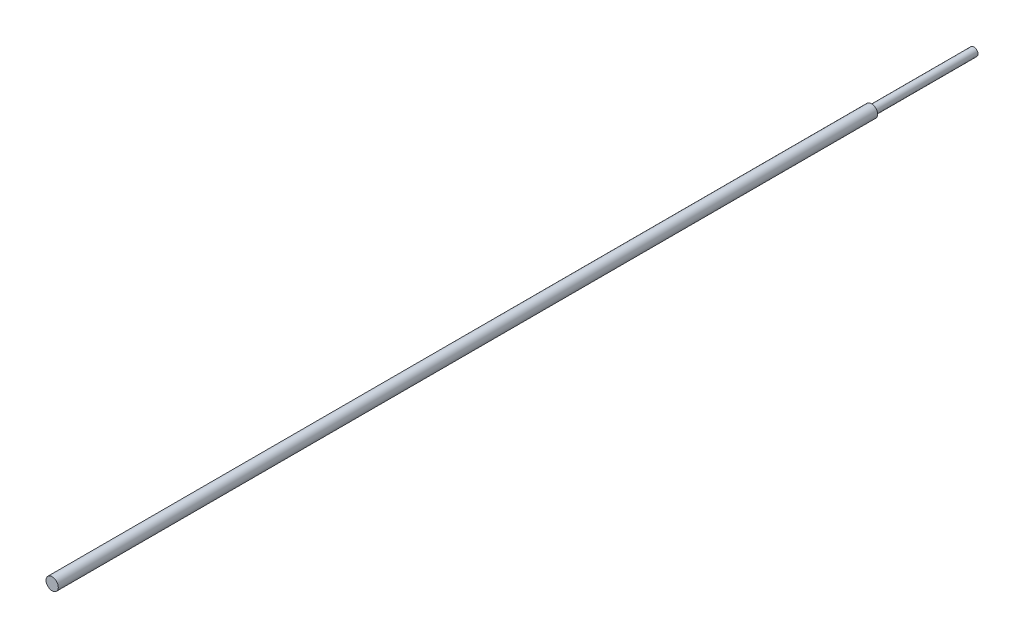
from build123d import *

# Parameters (mm, degrees)
SKETCH_1_R      = 0.6
EXTRUDE_1_DEPTH = 80
SKETCH_2_R      = 0.4
EXTRUDE_2_DEPTH = 10


with BuildPart() as part:
    # Эскиз1 → Вытянуть1 (new body)
    with BuildSketch(Plane.XY):
        Circle(SKETCH_1_R)
    extrude(amount=EXTRUDE_1_DEPTH)

    # Эскиз2 → Вытянуть2 (add)
    with BuildSketch(Plane(origin=(0, 0, 0), x_dir=(-1, 0, 0), z_dir=(0, 0, -1))):
        with Locations(Location((0, 0, 0), (0, 0, 180))):
            Circle(SKETCH_2_R)
    extrude(amount=EXTRUDE_2_DEPTH)


solid = part.part
